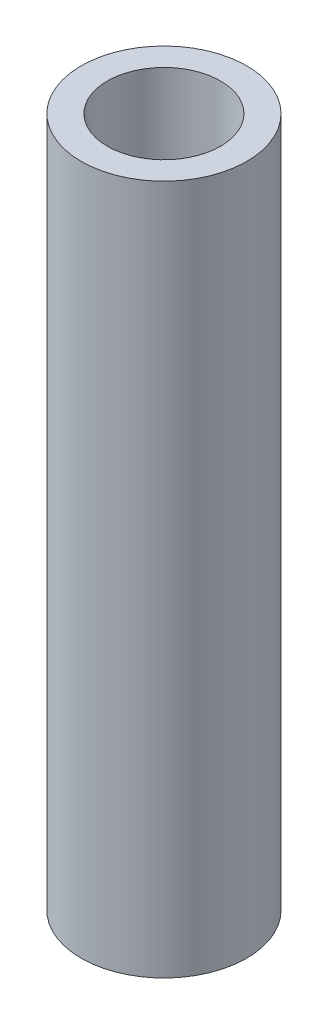
from build123d import *

# Parameters (mm, degrees)
SKETCH1_R           = 6
SKETCH1_R_2         = 4.1
BOSS_EXTRUDE1_DEPTH = 50


with BuildPart() as part:
    # Sketch1 → Boss-Extrude1 (new body)
    with BuildSketch(Plane(origin=(0, 0, 0), x_dir=(1, 0, 0), z_dir=(0, 1, 0))):
        with Locations(Location((0, 0, 0), (0, 0, 270))):
            Circle(SKETCH1_R)
        with Locations(Location((0, 0, 0), (0, 0, 270))):
            Circle(SKETCH1_R_2, mode=Mode.SUBTRACT)
    extrude(amount=BOSS_EXTRUDE1_DEPTH)


solid = part.part
